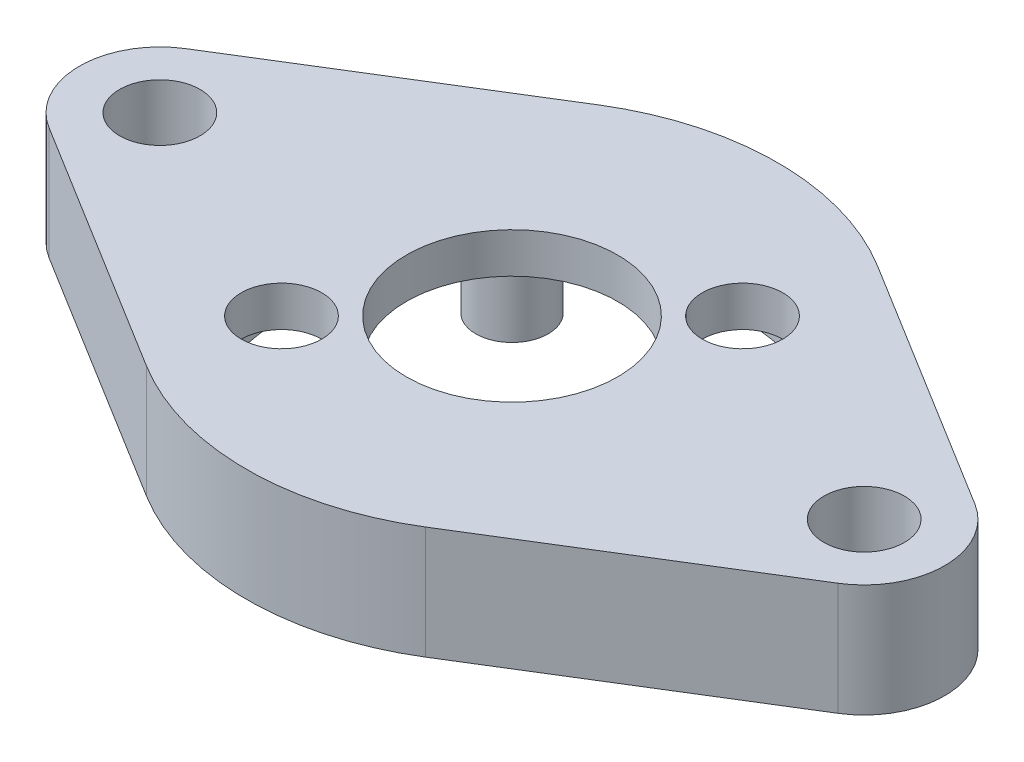
from build123d import *

# Parameters (mm, degrees)
SKETCH1_R           = 2
SKETCH1_R_2         = 13.2
SKETCH1_R_3         = 11.2
BOSS_EXTRUDE1_DEPTH = 3.6
SKETCH2_R           = 2
SKETCH2_R_2         = 5.25
BOSS_EXTRUDE2_DEPTH = 2
SKETCH3_R           = 2
CUT_EXTRUDE1_DEPTH  = 2
SKETCH4_R           = 1.8
BOSS_EXTRUDE3_DEPTH = 3.6


with BuildPart() as part:
    # Sketch1 → Boss-Extrude1 (new body)
    # profile 1 of 3: a face of its own
    with BuildSketch(Plane(origin=(0, 0, 0), x_dir=(1, 0, 0), z_dir=(0, 1, 0))):
        with BuildLine():
            ThreePointArc((-6.939428571, -11.228727938), (-13.2, 0), (-6.939428571, 11.228727938))
            Line((-6.939428571, 11.228727938), (-19.602857143, 3.40264483))
            ThreePointArc((-19.602857143, 3.40264483), (-21.5, 0), (-19.602857143, -3.40264483))
            Line((-19.602857143, -3.40264483), (-6.939428571, -11.228727938))
        make_face()
        with Locations(Location((-17.5, 0, 0), (0, 0, 270))):
            Circle(SKETCH1_R, mode=Mode.SUBTRACT)
    # profile 2 of 3: a face of its own
    with BuildSketch(Plane(origin=(0, 0, 0), x_dir=(1, 0, 0), z_dir=(0, 1, 0))):
        Circle(SKETCH1_R_2)
        with Locations(Location((0, 0, 0), (0, 0, 270))):
            Circle(SKETCH1_R_3, mode=Mode.SUBTRACT)
    # profile 3 of 3: a face of its own
    with BuildSketch(Plane(origin=(0, 0, 0), x_dir=(1, 0, 0), z_dir=(0, 1, 0))):
        with BuildLine():
            Line((19.602857143, 3.40264483), (6.939428571, 11.228727938))
            ThreePointArc((6.939428571, 11.228727938), (11.529103546, 6.428045693), (13.2, 0))
            ThreePointArc((13.2, 0), (11.529103546, -6.428045693), (6.939428571, -11.228727938))
            Line((6.939428571, -11.228727938), (19.602857143, -3.40264483))
            ThreePointArc((19.602857143, -3.40264483), (21.5, 0), (19.602857143, 3.40264483))
        make_face()
        with Locations(Location((17.5, 0, 0), (0, 0, 270))):
            Circle(SKETCH1_R, mode=Mode.SUBTRACT)
    extrude(amount=BOSS_EXTRUDE1_DEPTH)

    # Sketch2 → Boss-Extrude2 (add)
    with BuildSketch(Plane(origin=(0, 3.6, 0), x_dir=(1, 0, 0), z_dir=(0, 1, 0))):
        with BuildLine():
            Line((-6.939428571, 11.228727938), (-19.602857143, 3.40264483))
            ThreePointArc((-19.602857143, 3.40264483), (-21.5, 0), (-19.602857143, -3.40264483))
            Line((-19.602857143, -3.40264483), (-6.939428571, -11.228727938))
            ThreePointArc((-6.939428571, -11.228727938), (0, -13.2), (6.939428571, -11.228727938))
            Line((6.939428571, -11.228727938), (19.602857143, -3.40264483))
            ThreePointArc((19.602857143, -3.40264483), (21.5, 0), (19.602857143, 3.40264483))
            Line((19.602857143, 3.40264483), (6.939428571, 11.228727938))
            ThreePointArc((6.939428571, 11.228727938), (0, 13.2), (-6.939428571, 11.228727938))
        make_face()
        with Locations(Location((17.5, 0, 0), (0, 0, 270))):
            Circle(SKETCH2_R, mode=Mode.SUBTRACT)
        with Locations(Location((-17.5, 0, 0), (0, 0, 270))):
            Circle(SKETCH2_R, mode=Mode.SUBTRACT)
        with Locations(Location((0, 0, 0), (0, 0, 270))):
            Circle(SKETCH2_R_2, mode=Mode.SUBTRACT)
    extrude(amount=BOSS_EXTRUDE2_DEPTH)

    # Sketch3 → Cut-Extrude1 (cut)
    with BuildSketch(Plane(origin=(0, 5.6, 0), x_dir=(1, 0, 0), z_dir=(0, 1, 0))):
        with Locations(Location((5.727564928, 5.727564928, 0), (0, 0, 270))):
            Circle(SKETCH3_R)
        with Locations(Location((-5.727564928, -5.727564928, 0), (0, 0, 270))):
            Circle(SKETCH3_R)
    extrude(amount=-CUT_EXTRUDE1_DEPTH, mode=Mode.SUBTRACT)

    # Sketch4 → Boss-Extrude3 (add)
    with BuildSketch(Plane.XZ.offset(-3.6)):
        with Locations(Location((5.727564928, 5.727564928, 0), (0, 0, 90))):
            Circle(SKETCH4_R)
        with Locations(Location((-5.727564928, -5.727564928, 0), (0, 0, 90))):
            Circle(SKETCH4_R)
    extrude(amount=BOSS_EXTRUDE3_DEPTH)


solid = part.part
